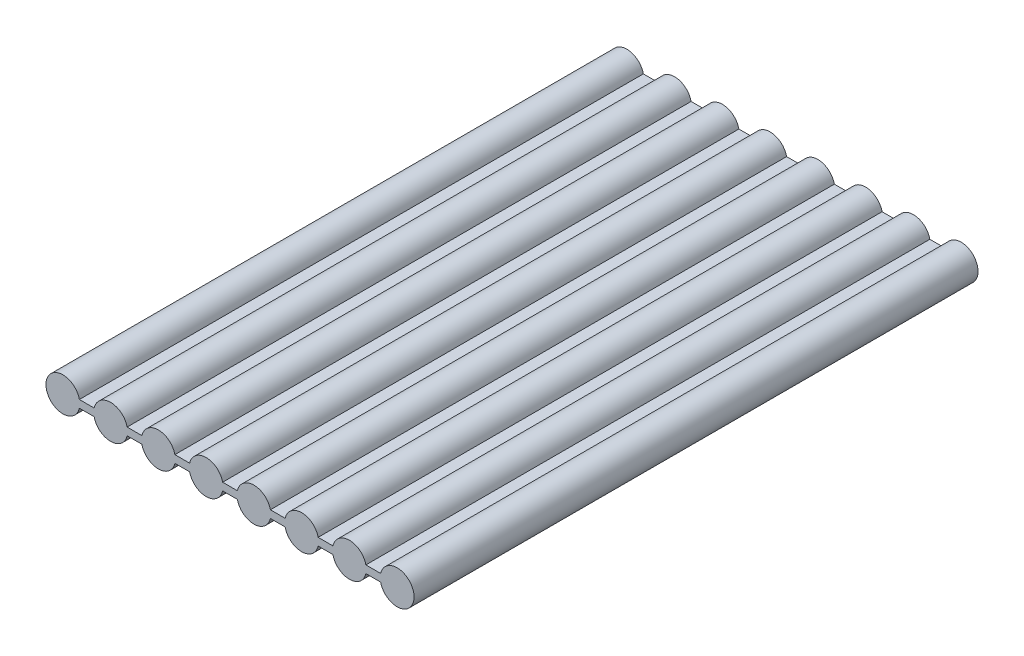
from build123d import *

# Parameters (mm, degrees)
ESQUISSE1_R                = 0.45
BOSS_EXTRU_1_DEPTH         = 7.5
R_P_TITION_LIN_AIRE1_COUNT = 8
R_P_TITION_LIN_AIRE1_PITCH = 1.27
BOSS_EXTRU_2_DEPTH         = 7.5
R_P_TITION_LIN_AIRE2_COUNT = 7
R_P_TITION_LIN_AIRE2_PITCH = 1.27


with BuildPart() as part:
    # Esquisse1 → Boss.-Extru.1 (new, symmetric)
    with BuildSketch(Plane.XY):
        with Locations((-4.445, 0)):
            Circle(ESQUISSE1_R)
    extrude(amount=BOSS_EXTRU_1_DEPTH, both=True)


with BuildPart() as r_p_tition_lin_aire1_1:
    # Répétition linéaire1: pattern copy
    add(part.part.moved(Location(Vector(1, 0, 0) * (1 * R_P_TITION_LIN_AIRE1_PITCH))))


with BuildPart() as r_p_tition_lin_aire1_2:
    # Répétition linéaire1: pattern copy
    add(part.part.moved(Location(Vector(1, 0, 0) * (2 * R_P_TITION_LIN_AIRE1_PITCH))))


with BuildPart() as r_p_tition_lin_aire1_3:
    # Répétition linéaire1: pattern copy
    add(part.part.moved(Location(Vector(1, 0, 0) * (3 * R_P_TITION_LIN_AIRE1_PITCH))))


with BuildPart() as r_p_tition_lin_aire1_4:
    # Répétition linéaire1: pattern copy
    add(part.part.moved(Location(Vector(1, 0, 0) * (4 * R_P_TITION_LIN_AIRE1_PITCH))))


with BuildPart() as r_p_tition_lin_aire1_5:
    # Répétition linéaire1: pattern copy
    add(part.part.moved(Location(Vector(1, 0, 0) * (5 * R_P_TITION_LIN_AIRE1_PITCH))))


with BuildPart() as r_p_tition_lin_aire1_6:
    # Répétition linéaire1: pattern copy
    add(part.part.moved(Location(Vector(1, 0, 0) * (6 * R_P_TITION_LIN_AIRE1_PITCH))))


with BuildPart() as r_p_tition_lin_aire1_7:
    # Répétition linéaire1: pattern copy
    add(part.part.moved(Location(Vector(1, 0, 0) * (7 * R_P_TITION_LIN_AIRE1_PITCH))))


with BuildPart() as part_1:
    add(part.part)

    add(r_p_tition_lin_aire1_1.part)  # Boss.-Extru.2 merges Répétition linéaire1_1
    # Esquisse2 → Boss.-Extru.2 (add, symmetric)
    with BuildSketch(Plane.XY):
        with BuildLine():
            Line((-4.006251781, 0.1), (-3.613748219, 0.1))
            ThreePointArc((-3.613748219, 0.1), (-3.625, 0), (-3.613748219, -0.1))
            Line((-3.613748219, -0.1), (-4.006251781, -0.1))
            ThreePointArc((-4.006251781, -0.1), (-3.995, 0), (-4.006251781, 0.1))
        make_face()
    boss_extru_2 = extrude(amount=BOSS_EXTRU_2_DEPTH, both=True)

    add(r_p_tition_lin_aire1_2.part)  # Répétition linéaire2 merges Répétition linéaire1_2

    add(r_p_tition_lin_aire1_3.part)  # Répétition linéaire2 merges Répétition linéaire1_3

    add(r_p_tition_lin_aire1_4.part)  # Répétition linéaire2 merges Répétition linéaire1_4

    add(r_p_tition_lin_aire1_5.part)  # Répétition linéaire2 merges Répétition linéaire1_5

    add(r_p_tition_lin_aire1_6.part)  # Répétition linéaire2 merges Répétition linéaire1_6

    add(r_p_tition_lin_aire1_7.part)  # Répétition linéaire2 merges Répétition linéaire1_7
    # Répétition linéaire2: Boss.-Extru.2 ×7
    with Locations(*[(i * R_P_TITION_LIN_AIRE2_PITCH, 0, 0) for i in range(1, R_P_TITION_LIN_AIRE2_COUNT)]):
        add(boss_extru_2)


solid = part_1.part
